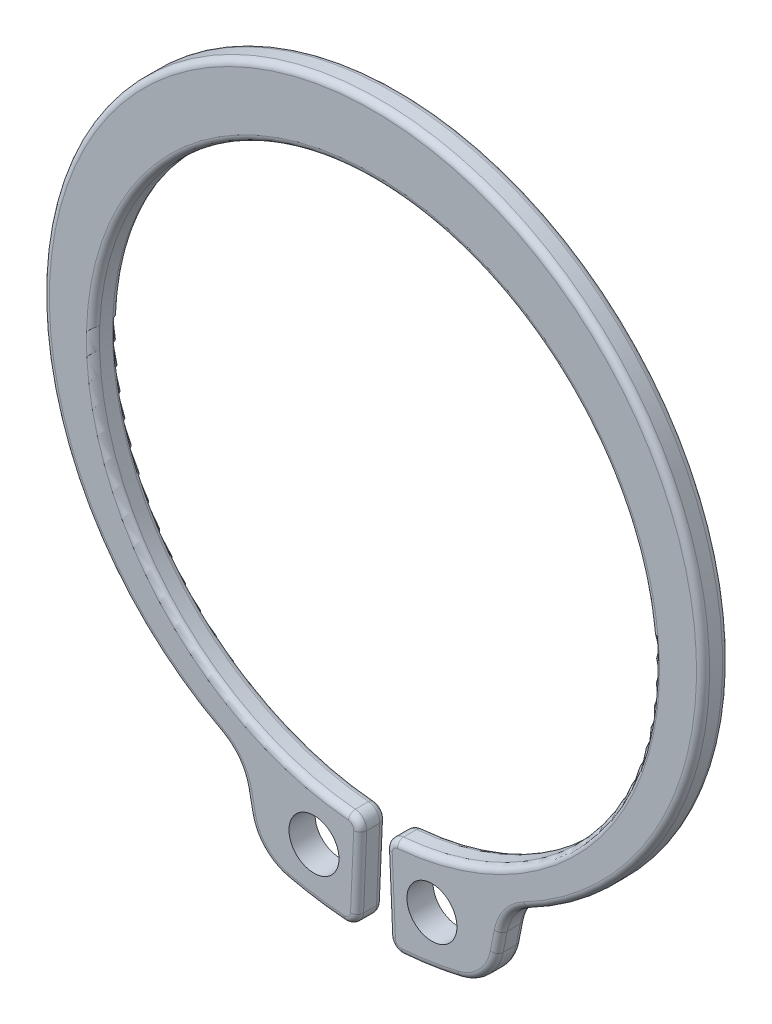
from build123d import *

# Parameters (mm, degrees)
SKETCH2_R           = 1.4375
BOSS_EXTRUDE1_DEPTH = 0.75
FILLET1_R           = 2.858022524
FILLET2_R           = 0.714505631
FILLET3_R           = 0.375


with BuildPart() as part:
    # Sketch2 → Boss-Extrude1 (new, symmetric)
    with BuildSketch(Plane.XY):
        with BuildLine():
            Line((-6.770512944, -20.638502894), (-7.618573953, -16.363368569))
            ThreePointArc((-7.618573953, -16.363368569), (-18.57644505, 4.912217361), (0, 20))
            Line((0, 20), (0, 16.1))
            ThreePointArc((0, 16.1), (-16.096168636, 0.351219649), (-0.702272137, -16.084676367))
            Line((-0.702272137, -16.084676367), (-0.947442461, -21.7))
            ThreePointArc((-0.947442461, -21.7), (-3.895305243, -21.368533976), (-6.770512944, -20.638502894))
        make_face()
        with Locations((-3.391309861, -18.603759003)):
            Circle(SKETCH2_R, mode=Mode.SUBTRACT)
    extrude(amount=BOSS_EXTRUDE1_DEPTH, both=True)

    # Fillet1
    fillet1_edges = [part.edges().sort_by_distance(p)[0] for p in [
        (-6.770512944, -20.638502894, 0),
        (-7.618573953, -16.363368569, 0),
    ]]
    fillet(fillet1_edges, radius=FILLET1_R)

    # Fillet2
    fillet2_edges = [part.edges().sort_by_distance(p)[0] for p in [
        (-0.702272137, -16.084676367, 0),
        (-0.947442461, -21.7, 0),
    ]]
    fillet(fillet2_edges, radius=FILLET2_R)

    # Mirror1: part across plane


with BuildPart() as part_1:
    add(part.part)
    add(part.part.mirror(Plane(origin=(0, 20, 0.75), x_dir=(0, 0, 1), z_dir=(-1, 0, 0))))

    # Fillet3
    fillet3_edges = [part_1.edges().sort_by_distance(p)[0] for p in [
        (-3.332568695, -21.463495361, -0.75),
        (-3.332568695, -21.463495361, 0.75),
        (-7.226226943, -18.341217043, -0.75),
        (-6.36354693, -20.349795362, -0.75),
        (-7.226226943, -18.341217043, 0.75),
        (-6.36354693, -20.349795362, 0.75),
        (-7.855076454, -16.607490963, -0.75),
        (-7.855076454, -16.607490963, 0.75),
        (-0.824260959, -18.878679749, -0.75),
        (-0.824260959, -18.878679749, 0.75),
        (0, 16.1, -0.75),
        (-0.909673318, -16.280753418, -0.75),
        (-1.155888787, -21.477787852, -0.75),
        (16.085069553, 0.693208105, 0.75),
        (-0.909673318, -16.280753418, 0.75),
        (-18.428734346, 5.560452221, 0.75),
        (-1.155888787, -21.477787852, 0.75),
        (0.824260959, -18.878679749, -0.75),
        (7.226226943, -18.341217043, -0.75),
        (3.332568695, -21.463495361, -0.75),
        (7.226226943, -18.341217043, 0.75),
        (3.332568695, -21.463495361, 0.75),
        (0.824260959, -18.878679749, 0.75),
        (6.36354693, -20.349795362, 0.75),
        (6.36354693, -20.349795362, -0.75),
        (7.855076454, -16.607490963, 0.75),
        (7.855076454, -16.607490963, -0.75),
        (1.155888787, -21.477787852, 0.75),
        (1.155888787, -21.477787852, -0.75),
        (0.909673318, -16.280753418, 0.75),
        (0.909673318, -16.280753418, -0.75),
        (-18.428734346, 5.560452221, -0.75),
    ]]
    fillet(fillet3_edges, radius=FILLET3_R)


solid = part_1.part
